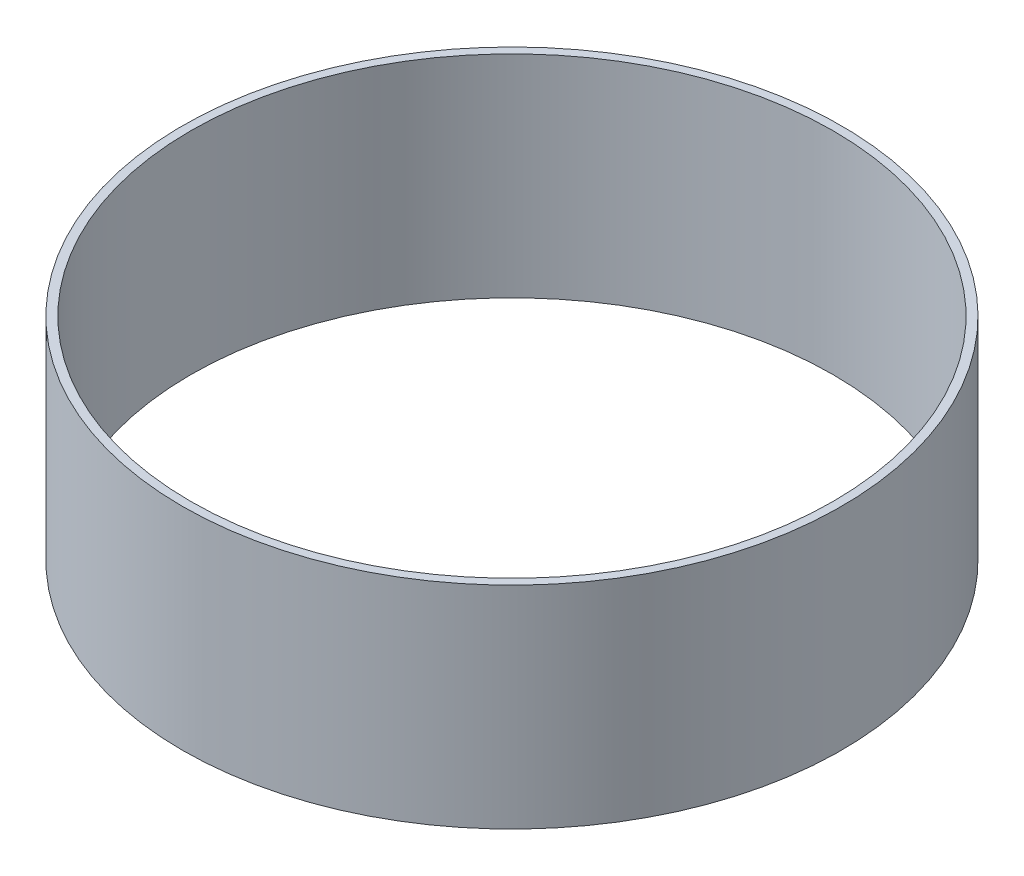
from build123d import *

# Parameters (mm, degrees)
BOSS_EXTRUDE1_DEPTH      = 25
BOSS_EXTRUDE1_DEPTH_BACK = 25
SKETCH1_R                = 78
SKETCH1_R_2              = 76


with BuildPart() as part:
    # Sketch1 → Boss-Extrude1 (new, two sides: drawn at the far end of the back side and taken through both)
    with BuildSketch(Plane(origin=(0, 0, 0), x_dir=(1, 0, 0), z_dir=(0, 1, 0)).offset(-BOSS_EXTRUDE1_DEPTH_BACK)):
        with Locations(Location((0, 0, 0), (0, 0, 270))):
            Circle(SKETCH1_R)
        with Locations(Location((0, 0, 0), (0, 0, 270))):
            Circle(SKETCH1_R_2, mode=Mode.SUBTRACT)
    extrude(amount=BOSS_EXTRUDE1_DEPTH + BOSS_EXTRUDE1_DEPTH_BACK)


solid = part.part
